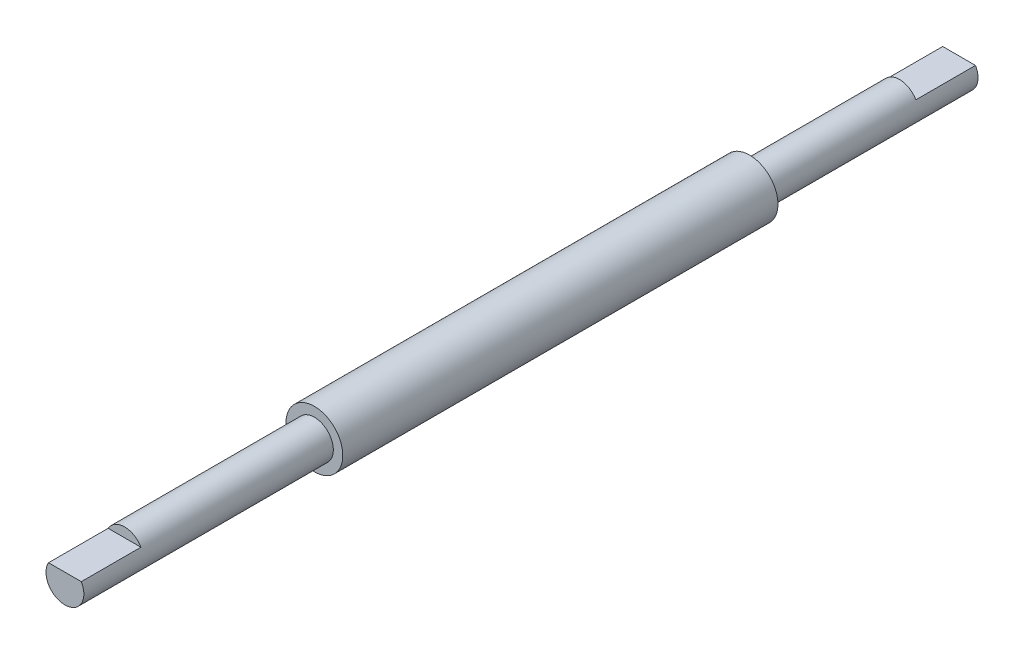
from build123d import *

# Parameters (mm, degrees)
SKETCH1_R           = 6.35
BOSS_EXTRUDE1_DEPTH = 300
BOSS_EXTRUDE2_START = -70.2975
SKETCH2_R           = 9.525
BOSS_EXTRUDE2_DEPTH = 146
CUT_EXTRUDE4_DEPTH  = 20
CUT_EXTRUDE5_START  = 280
CUT_EXTRUDE5_DEPTH  = 20


with BuildPart() as part:
    # Sketch1 → Boss-Extrude1 (new body)
    with BuildSketch(Plane.XY):
        Circle(SKETCH1_R)
    extrude(amount=BOSS_EXTRUDE1_DEPTH)

    # Sketch2 → Boss-Extrude2 (add)
    with BuildSketch(Plane(origin=(0, 0, 0), x_dir=(-1, 0, 0), z_dir=(0, 0, -1)).offset(BOSS_EXTRUDE2_START)):
        Circle(SKETCH2_R)
    extrude(amount=-BOSS_EXTRUDE2_DEPTH)

    # Sketch7 → Cut-Extrude4 (cut)
    with BuildSketch(Plane.XY):
        with BuildLine():
            Line((-5.499261314, 3.175), (5.499261314, 3.175))
            ThreePointArc((5.499261314, 3.175), (0, 6.35), (-5.499261314, 3.175))
        make_face()
    extrude(amount=CUT_EXTRUDE4_DEPTH, mode=Mode.SUBTRACT)

    # Sketch7<3> → Cut-Extrude5 (cut)
    with BuildSketch(Plane.XY.offset(CUT_EXTRUDE5_START)):
        with BuildLine():
            Line((-5.499261314, 3.175), (5.499261314, 3.175))
            ThreePointArc((5.499261314, 3.175), (0, 6.35), (-5.499261314, 3.175))
        make_face()
    extrude(amount=CUT_EXTRUDE5_DEPTH, mode=Mode.SUBTRACT)


solid = part.part
